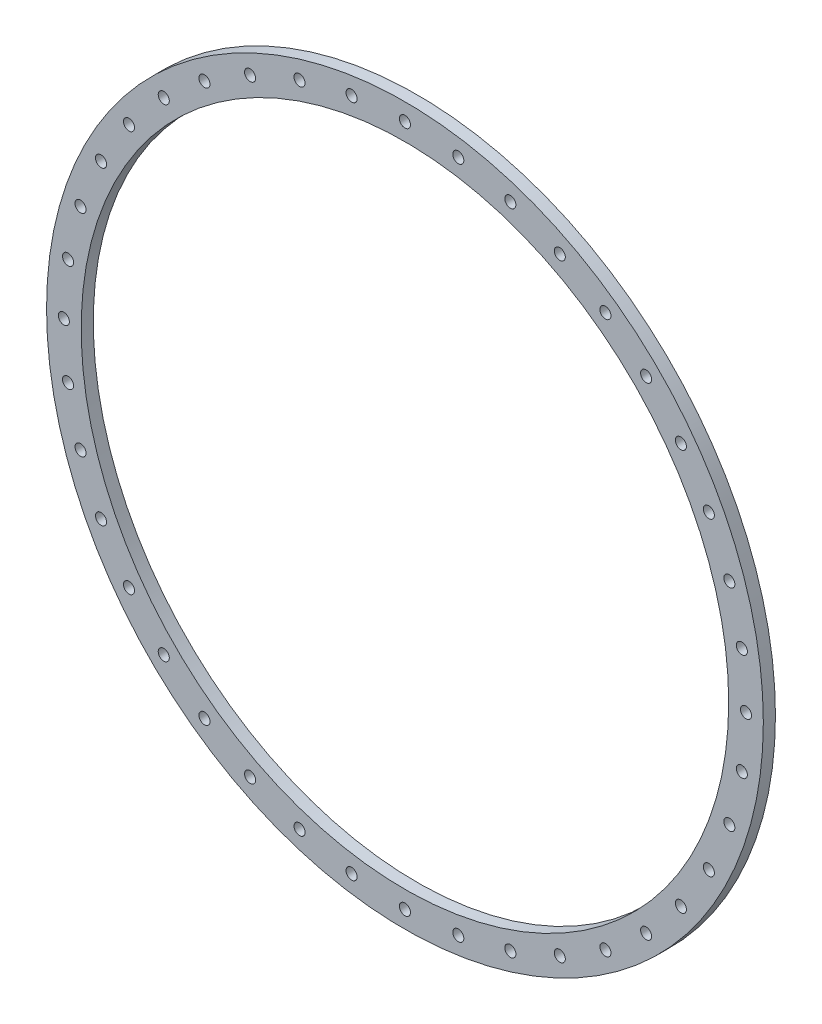
from build123d import *

# Parameters (mm, degrees)
SKETCH_1_R      = 103.5
SKETCH_1_R_2    = 93.5
SKETCH_1_R_3    = 1.6
EXTRUDE_1_DEPTH = 3.5


with BuildPart() as part:
    # 草图1 → 凸台-拉伸1 (new body)
    with BuildSketch(Plane.XY):
        Circle(SKETCH_1_R)
        Circle(SKETCH_1_R_2, mode=Mode.SUBTRACT)
        with Locations((0, 98.5)):
            Circle(SKETCH_1_R_3, mode=Mode.SUBTRACT)
        with Locations((15.408794806, 97.287301549)):
            Circle(SKETCH_1_R_3, mode=Mode.SUBTRACT)
        with Locations((30.438173946, 93.679066855)):
            Circle(SKETCH_1_R_3, mode=Mode.SUBTRACT)
        with Locations((44.718064224, 87.764142633)):
            Circle(SKETCH_1_R_3, mode=Mode.SUBTRACT)
        with Locations((57.896847351, 79.688173946)):
            Circle(SKETCH_1_R_3, mode=Mode.SUBTRACT)
        with Locations((69.650017947, 69.650017947)):
            Circle(SKETCH_1_R_3, mode=Mode.SUBTRACT)
        with Locations((79.688173946, 57.896847351)):
            Circle(SKETCH_1_R_3, mode=Mode.SUBTRACT)
        with Locations((87.764142633, 44.718064224)):
            Circle(SKETCH_1_R_3, mode=Mode.SUBTRACT)
        with Locations((93.679066855, 30.438173946)):
            Circle(SKETCH_1_R_3, mode=Mode.SUBTRACT)
        with Locations((97.287301549, 15.408794806)):
            Circle(SKETCH_1_R_3, mode=Mode.SUBTRACT)
        with Locations((98.5, 0)):
            Circle(SKETCH_1_R_3, mode=Mode.SUBTRACT)
        with Locations((97.287301549, -15.408794806)):
            Circle(SKETCH_1_R_3, mode=Mode.SUBTRACT)
        with Locations((93.679066855, -30.438173946)):
            Circle(SKETCH_1_R_3, mode=Mode.SUBTRACT)
        with Locations((87.764142633, -44.718064224)):
            Circle(SKETCH_1_R_3, mode=Mode.SUBTRACT)
        with Locations((79.688173946, -57.896847351)):
            Circle(SKETCH_1_R_3, mode=Mode.SUBTRACT)
        with Locations((69.650017947, -69.650017947)):
            Circle(SKETCH_1_R_3, mode=Mode.SUBTRACT)
        with Locations((57.896847351, -79.688173946)):
            Circle(SKETCH_1_R_3, mode=Mode.SUBTRACT)
        with Locations((44.718064224, -87.764142633)):
            Circle(SKETCH_1_R_3, mode=Mode.SUBTRACT)
        with Locations((30.438173946, -93.679066855)):
            Circle(SKETCH_1_R_3, mode=Mode.SUBTRACT)
        with Locations((15.408794806, -97.287301549)):
            Circle(SKETCH_1_R_3, mode=Mode.SUBTRACT)
        with Locations((0, -98.5)):
            Circle(SKETCH_1_R_3, mode=Mode.SUBTRACT)
        with Locations((-15.408794806, -97.287301549)):
            Circle(SKETCH_1_R_3, mode=Mode.SUBTRACT)
        with Locations((-30.438173946, -93.679066855)):
            Circle(SKETCH_1_R_3, mode=Mode.SUBTRACT)
        with Locations((-44.718064224, -87.764142633)):
            Circle(SKETCH_1_R_3, mode=Mode.SUBTRACT)
        with Locations((-57.896847351, -79.688173946)):
            Circle(SKETCH_1_R_3, mode=Mode.SUBTRACT)
        with Locations((-69.650017947, -69.650017947)):
            Circle(SKETCH_1_R_3, mode=Mode.SUBTRACT)
        with Locations((-79.688173946, -57.896847351)):
            Circle(SKETCH_1_R_3, mode=Mode.SUBTRACT)
        with Locations((-87.764142633, -44.718064224)):
            Circle(SKETCH_1_R_3, mode=Mode.SUBTRACT)
        with Locations((-93.679066855, -30.438173946)):
            Circle(SKETCH_1_R_3, mode=Mode.SUBTRACT)
        with Locations((-97.287301549, -15.408794806)):
            Circle(SKETCH_1_R_3, mode=Mode.SUBTRACT)
        with Locations((-98.5, 0)):
            Circle(SKETCH_1_R_3, mode=Mode.SUBTRACT)
        with Locations((-97.287301549, 15.408794806)):
            Circle(SKETCH_1_R_3, mode=Mode.SUBTRACT)
        with Locations((-93.679066855, 30.438173946)):
            Circle(SKETCH_1_R_3, mode=Mode.SUBTRACT)
        with Locations((-87.764142633, 44.718064224)):
            Circle(SKETCH_1_R_3, mode=Mode.SUBTRACT)
        with Locations((-79.688173946, 57.896847351)):
            Circle(SKETCH_1_R_3, mode=Mode.SUBTRACT)
        with Locations((-69.650017947, 69.650017947)):
            Circle(SKETCH_1_R_3, mode=Mode.SUBTRACT)
        with Locations((-57.896847351, 79.688173946)):
            Circle(SKETCH_1_R_3, mode=Mode.SUBTRACT)
        with Locations((-44.718064224, 87.764142633)):
            Circle(SKETCH_1_R_3, mode=Mode.SUBTRACT)
        with Locations((-30.438173946, 93.679066855)):
            Circle(SKETCH_1_R_3, mode=Mode.SUBTRACT)
        with Locations((-15.408794806, 97.287301549)):
            Circle(SKETCH_1_R_3, mode=Mode.SUBTRACT)
    extrude(amount=EXTRUDE_1_DEPTH)


solid = part.part
